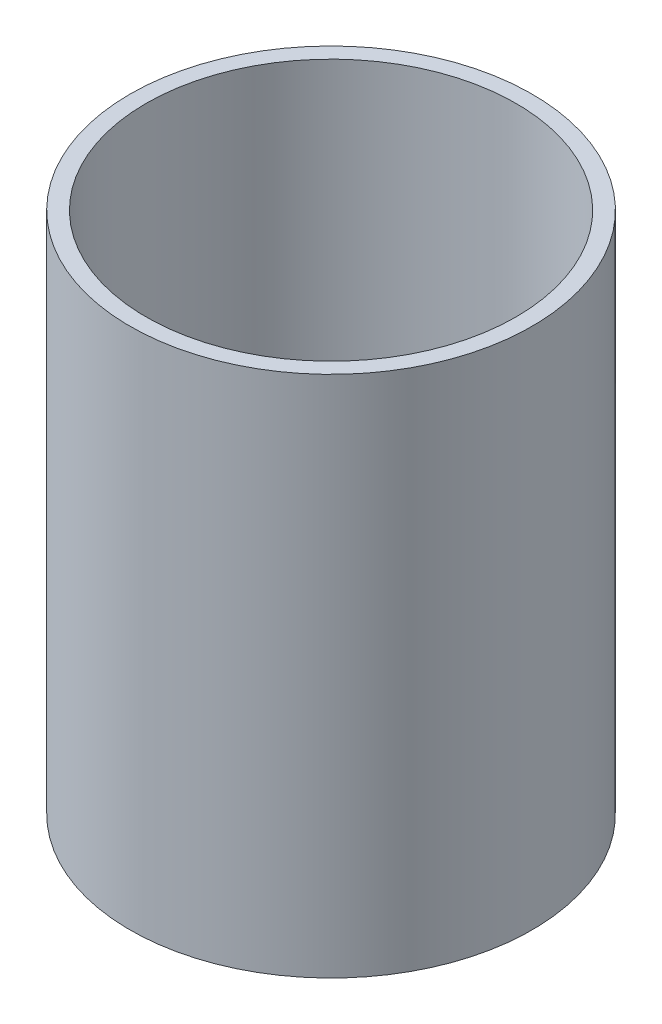
from build123d import *

# Parameters (mm, degrees)
SKETCH_2_W = 50
SKETCH_2_H = 130
SHELL_1_T  = -4


with BuildPart() as part:
    # 草图2 → 旋转1 (revolve)
    with BuildSketch(Plane.XY, mode=Mode.PRIVATE) as revolve_1_sk:
        with Locations((25, 65)):
            Rectangle(SKETCH_2_W, SKETCH_2_H)
    revolve(revolve_1_sk.sketch.rotate(Axis((0, 130, 0), (0, -1, 0)), 180), axis=Axis((0, 130, 0), (0, -1, 0)))

    # 抽壳1
    shell_1_openings = [part.faces().sort_by_distance(p)[0] for p in [
        (0, 130, 0),
    ]]
    offset(amount=SHELL_1_T, openings=shell_1_openings, kind=Kind.INTERSECTION)


solid = part.part
